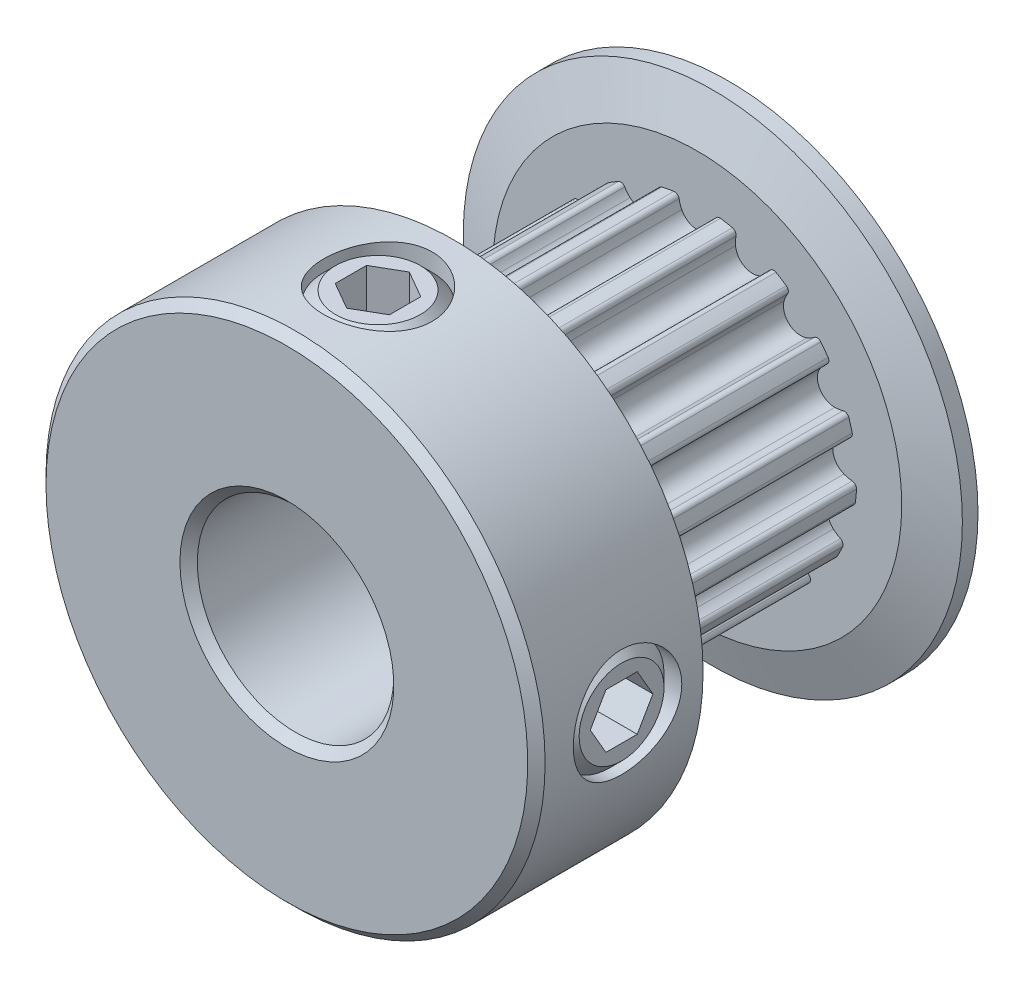
from build123d import *

# Parameters (mm, degrees)
CUT_EXTRUDE1_START = 1.245
CUT_EXTRUDE1_DEPTH = 7.37
CIRPATTERN1_COUNT  = 17
SKETCH4_R          = 1.7526
CUT_EXTRUDE2_DEPTH = 14.452901007
CUT_EXTRUDE3_DEPTH = 1.31445
CIRPATTERN3_COUNT  = 2
CIRPATTERN3_ANGLE  = 90
CHAMFER1_SIZE      = 0.28075


with BuildPart() as part:
    # Sketch2 → Revolve1 (revolve)
    with BuildSketch(Plane(origin=(0, 0, 0), x_dir=(0, 0, -1), z_dir=(1, 0, 0)), mode=Mode.PRIVATE) as revolve1_sk:
        Polygon((-7.135, 3.175), (7.135, 3.175), (7.135, 8.0645), (6.63, 8.0645), (6.125, 6.61025), (6.125, 5.156), (-1.245, 5.156), (-1.245, 6.61025), (-1.75, 8.0645), (-7.135, 8.0645), align=None)
    revolve(revolve1_sk.sketch.rotate(Axis((0, 0, 7.135), (0, 0, -1)), 90), axis=Axis((0, 0, 7.135), (0, 0, -1)))

    # Sketch3 → Cut-Extrude1 (cut)
    with BuildSketch(Plane.XY.offset(CUT_EXTRUDE1_START)):
        with BuildLine():
            Line((3.14485679, 8.0645), (-3.14485679, 8.0645))
            Line((-3.14485679, 8.0645), (-1.873254065, 4.803671014))
            ThreePointArc((-1.873254065, 4.803671014), (-1.321856089, 4.983676603), (-0.75372918, 5.100610583))
            ThreePointArc((-0.75372918, 5.100610583), (-0.644283565, 5.074044072), (-0.584175174, 4.97880173))
            ThreePointArc((-0.584175174, 4.97880173), (-0.550527002, 4.845358053), (-0.498876404, 4.717797753))
            ThreePointArc((-0.498876404, 4.717797753), (0, 4.406), (0.498876404, 4.717797753))
            ThreePointArc((0.498876404, 4.717797753), (0.550527002, 4.845358053), (0.584175174, 4.97880173))
            ThreePointArc((0.584175174, 4.97880173), (0.644283565, 5.074044072), (0.75372918, 5.100610583))
            ThreePointArc((0.75372918, 5.100610583), (1.321856089, 4.983676603), (1.873254065, 4.803671014))
            Line((1.873254065, 4.803671014), (3.14485679, 8.0645))
        make_face()
    cut_extrude1 = extrude(amount=-CUT_EXTRUDE1_DEPTH, mode=Mode.SUBTRACT)

    # CirPattern1: Cut-Extrude1 ×17 about axis
    cirpattern1_axis = Axis((0, 0, 0), (0, 0, 1))
    for i in range(1, CIRPATTERN1_COUNT):
        add(cut_extrude1.rotate(cirpattern1_axis, i * 360 / CIRPATTERN1_COUNT), mode=Mode.SUBTRACT)

    # Sketch4 → Cut-Extrude2 (cut, through all)
    with BuildSketch(Plane(origin=(0, 0, 0), x_dir=(0, -1, 0), z_dir=(1, 0, 0))):
        with Locations(Location((0, -4.19, 0), (0, 0, 270))):
            Circle(SKETCH4_R)
    cut_extrude2 = extrude(amount=CUT_EXTRUDE2_DEPTH, mode=Mode.SUBTRACT)

    # Sketch5 → Revolve2 (revolve)
    with BuildSketch(Plane.XY.offset(4.19), mode=Mode.PRIVATE) as revolve2_sk:
        Polygon((3.175, -1.3716), (3.175, 0), (7.871756697, 0), (7.871756697, -1.3716), (7.490756697, -1.7526), (3.556, -1.7526), align=None)
    revolve2 = revolve(revolve2_sk.sketch.rotate(Axis((3.175, 0, 4.19), (1, 0, 0)), 270), axis=Axis((3.175, 0, 4.19), (1, 0, 0)))

    # Sketch6 → Cut-Extrude3 (cut)
    with BuildSketch(Plane(origin=(7.871756697, 5.384140679, 0), x_dir=(0, -1, 0), z_dir=(-1, 0, 0))):
        Polygon((5.384140679, 5.201864082), (4.507840679, 4.695932041), (4.507840679, 3.684067959), (5.384140679, 3.178135918), (6.260440679, 3.684067959), (6.260440679, 4.695932041), align=None)
    cut_extrude3 = extrude(amount=CUT_EXTRUDE3_DEPTH, mode=Mode.SUBTRACT)

    # CirPattern3: Cut-Extrude2, Revolve2, Cut-Extrude3 ×2 about axis
    cirpattern3_axis = Axis((0, 0, 0), (0, 0, 1))
    add([cut_extrude2.rotate(cirpattern3_axis, i * CIRPATTERN3_ANGLE / (CIRPATTERN3_COUNT - 1)) for i in range(1, CIRPATTERN3_COUNT)], mode=Mode.SUBTRACT)
    add([revolve2.rotate(cirpattern3_axis, i * CIRPATTERN3_ANGLE / (CIRPATTERN3_COUNT - 1)) for i in range(1, CIRPATTERN3_COUNT)])
    add([cut_extrude3.rotate(cirpattern3_axis, i * CIRPATTERN3_ANGLE / (CIRPATTERN3_COUNT - 1)) for i in range(1, CIRPATTERN3_COUNT)], mode=Mode.SUBTRACT)

    # Chamfer1
    chamfer1_edges = [part.edges().sort_by_distance(p)[0] for p in [
        (-3.175, 0, 7.135),
        (-8.0645, 0, 7.135),
    ]]
    chamfer(chamfer1_edges, length=CHAMFER1_SIZE)


solid = part.part
